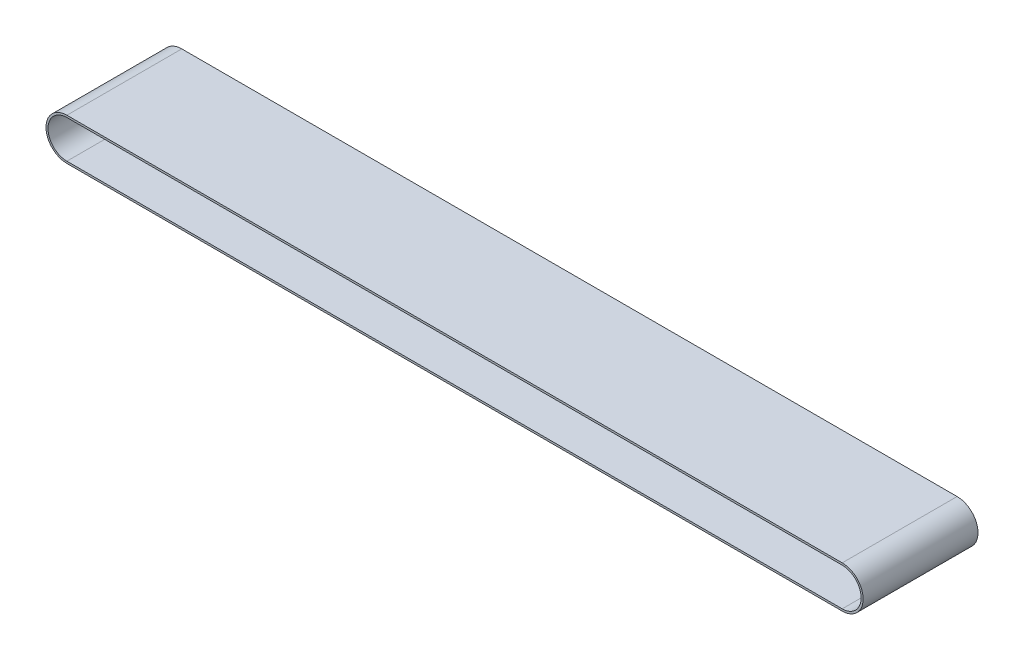
from build123d import *

# Parameters (mm, degrees)
BOSS_EXTRUDE1_DEPTH = 98.425
CUT_EXTRUDE1_REACH  = 692.094


with BuildPart() as part:
    # Sketch1 → Boss-Extrude1 (new body)
    with BuildSketch(Plane.XY):
        with BuildLine():
            Line((0, 35.8), (664.20000002, 35.8))
            ThreePointArc((664.20000002, 35.8), (682.10000002, 17.9), (664.20000002, 0))
            Line((664.20000002, 0), (0, 0))
            ThreePointArc((0, 0), (-17.9, 17.9), (0, 35.8))
        make_face()
    extrude(amount=BOSS_EXTRUDE1_DEPTH)

    # Sketch3 → Cut-Extrude1 (cut, up to next)
    with BuildSketch(Plane.XY.offset(98.425), mode=Mode.PRIVATE) as cut_extrude1_sk1:
        with BuildLine():
            Line((0, 34.1), (664.20000002, 34.1))
            ThreePointArc((664.20000002, 34.1), (680.40000002, 17.9), (664.20000002, 1.7))
            Line((664.20000002, 1.7), (0, 1.7))
            ThreePointArc((0, 1.7), (-16.2, 17.9), (0, 34.1))
        make_face()
    cut_extrude1_tool1 = extrude(cut_extrude1_sk1.sketch, amount=-CUT_EXTRUDE1_REACH, mode=Mode.PRIVATE) & part.part
    add(cut_extrude1_tool1.solids().sort_by_distance((332.1, 17.9, 98.425))[0], mode=Mode.SUBTRACT)


solid = part.part
